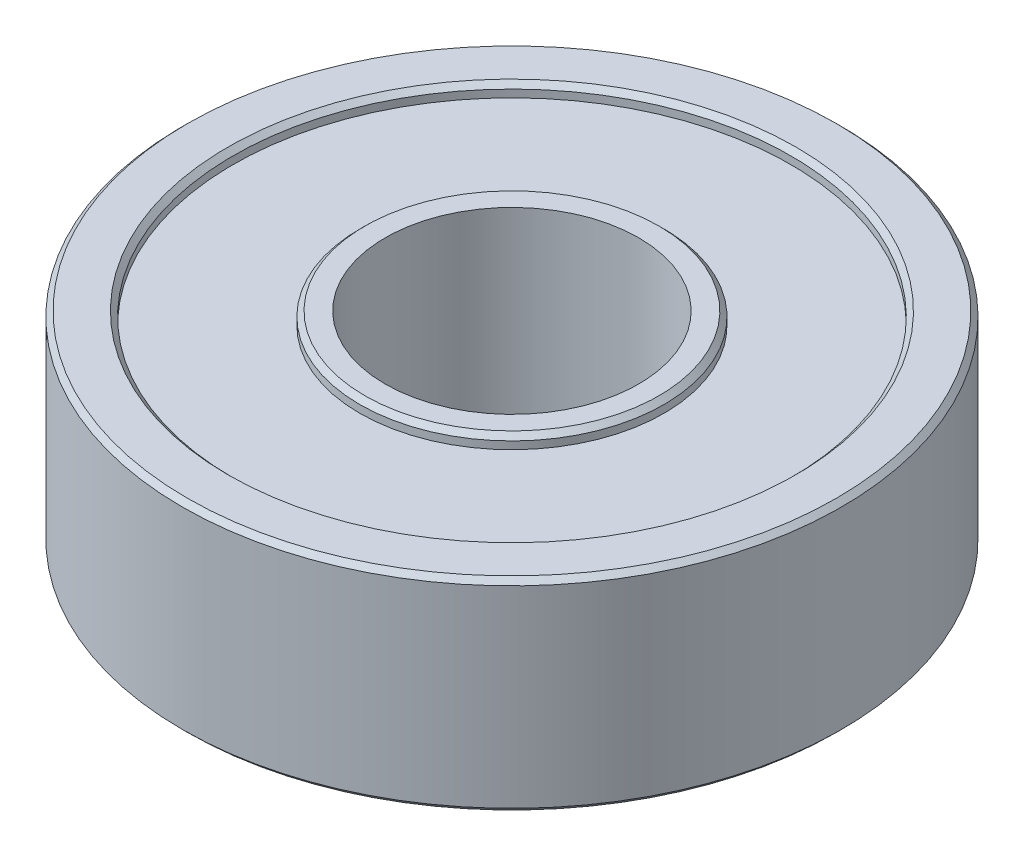
from build123d import *

# Parameters (mm, degrees)
SKETCH1_R           = 13
SKETCH1_R_2         = 5
BOSS_EXTRUDE1_DEPTH = 8
SKETCH2_R           = 11
SKETCH2_R_2         = 6
CUT_EXTRUDE1_DEPTH  = 0.5
CUT_EXTRUDE2_START  = -7.5
SKETCH2_2_R         = 11
SKETCH2_2_R_2       = 6
CUT_EXTRUDE2_DEPTH  = 0.5
CHAMFER1_SIZE       = 0.2


with BuildPart() as part:
    # Sketch1 → Boss-Extrude1 (new body)
    with BuildSketch(Plane(origin=(0, 0, 0), x_dir=(1, 0, 0), z_dir=(0, 1, 0))):
        with Locations(Location((0, 0, 0), (0, 0, 270))):
            Circle(SKETCH1_R)
        with Locations(Location((0, 0, 0), (0, 0, 270))):
            Circle(SKETCH1_R_2, mode=Mode.SUBTRACT)
    extrude(amount=BOSS_EXTRUDE1_DEPTH)

    # Sketch2 → Cut-Extrude1 (cut)
    with BuildSketch(Plane(origin=(0, 8, 0), x_dir=(1, 0, 0), z_dir=(0, 1, 0))):
        with Locations(Location((0, 0, 0), (0, 0, 270))):
            Circle(SKETCH2_R)
        with Locations(Location((0, 0, 0), (0, 0, 270))):
            Circle(SKETCH2_R_2, mode=Mode.SUBTRACT)
    extrude(amount=-CUT_EXTRUDE1_DEPTH, mode=Mode.SUBTRACT)

    # Sketch2<2> → Cut-Extrude2 (cut)
    with BuildSketch(Plane(origin=(0, 8, 0), x_dir=(1, 0, 0), z_dir=(0, 1, 0)).offset(CUT_EXTRUDE2_START)):
        with Locations(Location((0, 0, 0), (0, 0, 270))):
            Circle(SKETCH2_2_R)
        with Locations(Location((0, 0, 0), (0, 0, 270))):
            Circle(SKETCH2_2_R_2, mode=Mode.SUBTRACT)
    extrude(amount=-CUT_EXTRUDE2_DEPTH, mode=Mode.SUBTRACT)

    # Chamfer1
    chamfer1_edges = [part.edges().sort_by_distance(p)[0] for p in [
        (0, 8, -11),
        (0, 8, -6),
        (0, 0, -6),
        (0, 0, -11),
        (0, 0, -13),
        (0, 8, -13),
    ]]
    chamfer(chamfer1_edges, length=CHAMFER1_SIZE)


solid = part.part
